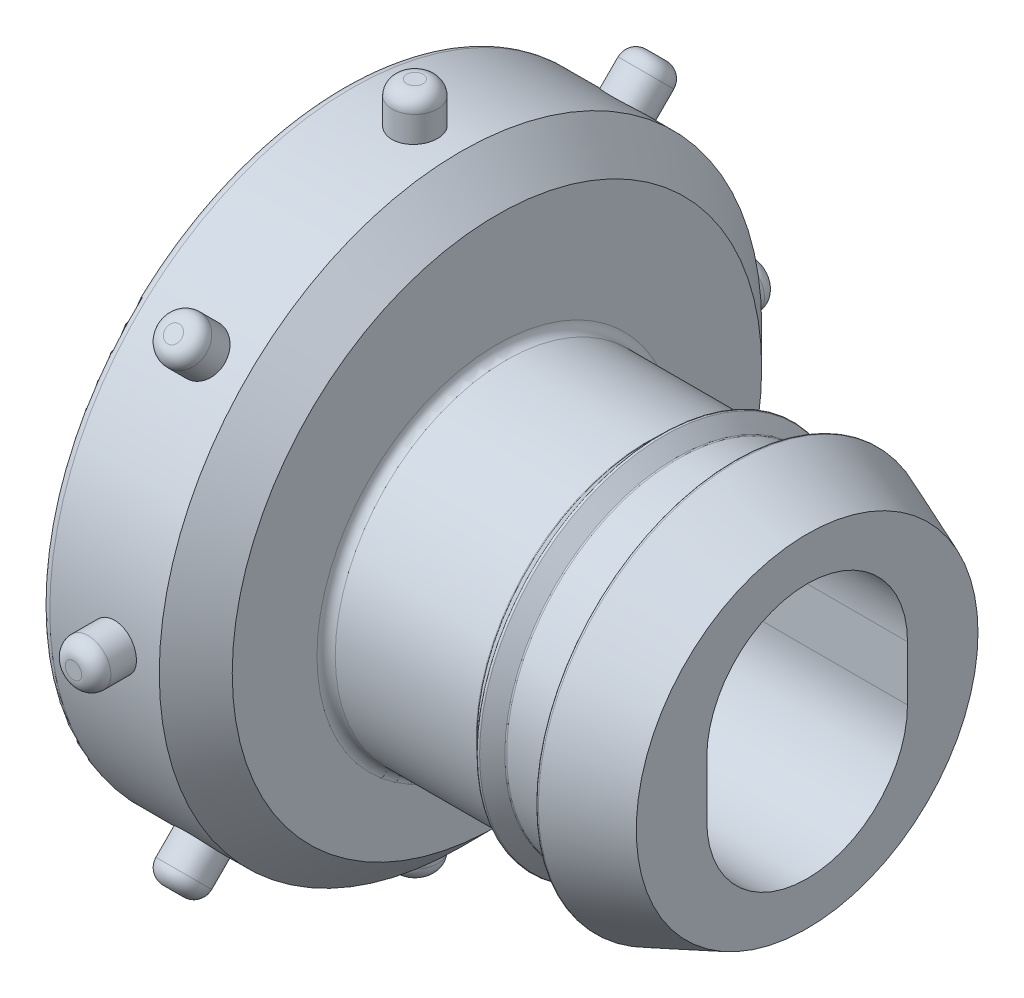
from build123d import *

# Parameters (mm, degrees)
SKETCH2_R                = 16.51
BOSS_EXTRUDE1_DEPTH      = 8.5
SKETCH4_W                = 18.18
SKETCH4_H                = 13.2
CUT_EXTRUDE1_DEPTH       = 7
SKETCH6_R                = 0.9
BOSS_EXTRUDE2_START      = -2
SKETCH7_R                = 1.25
BOSS_EXTRUDE2_DEPTH      = 4.2
FILLET2_R                = 0.8
CIRPATTERN1_COUNT        = 8
FILLET2_OF_CIRPATTERN1_R = 0.8
FILLET4_R                = 0.1
CUT_EXTRUDE2_DEPTH       = 33.365231345
CUT_EXTRUDE2_DEPTH_BACK  = 33.365231345
SKETCH8_W                = 3.59
SKETCH8_H                = 7.65
BOSS_EXTRUDE3_DEPTH      = 0.64
FILLET5_R                = 0.5
FILLET6_R                = 0.5
CHAMFER1_SIZE            = 2
FILLET7_R                = 1
CHAMFER2_SIZE            = 1
CHAMFER2_SIZE2           = 6
FILLET8_R                = 0.5


with BuildPart() as part:
    # Sketch1 → Revolve1 (revolve)
    with BuildSketch(Plane(origin=(0, 0, 0), x_dir=(1, 0, 0), z_dir=(0, 1, 0))):
        Polygon((0, 0), (-17, 0), (-17, 9.365), (-8.73, 9.365), (-7.94, 10.155), (-7.15, 9.365), (-3.97, 9.365), (-3.97, 10.955), (0, 9.365), align=None)
    revolve(axis=Axis((0, 0, 0), (-1, 0, 0)))

    # Sketch2 → Boss-Extrude1 (add)
    with BuildSketch(Plane.ZY.offset(17)):
        with Locations((0, 1.5)):
            Circle(SKETCH2_R)
        with BuildLine():
            ThreePointArc((-5.5, 1.5), (0, 7), (5.5, 1.5))
            Line((5.5, 1.5), (5.5, -1.5))
            ThreePointArc((5.5, -1.5), (0, -7), (-5.5, -1.5))
            Line((-5.5, -1.5), (-5.5, 1.5))
        make_face(mode=Mode.SUBTRACT)
    extrude(amount=BOSS_EXTRUDE1_DEPTH)

    # Sketch4 → Cut-Extrude1 (cut)
    with BuildSketch(Plane.ZY.offset(25.5)):
        with Locations((0, 1.029757623)):
            Rectangle(SKETCH4_W, SKETCH4_H)
    extrude(amount=-CUT_EXTRUDE1_DEPTH, mode=Mode.SUBTRACT)

    # Sketch6 → Cut-Revolve1 (revolve, cut)
    with BuildSketch(Plane.XY, mode=Mode.PRIVATE) as cut_revolve1_sk:
        with Locations((-25.5, 15.64)):
            Circle(SKETCH6_R)
    revolve(cut_revolve1_sk.sketch.rotate(Axis((-25.5, 1.5, 0), (1, 0, 0)), 90), axis=Axis((-25.5, 1.5, 0), (1, 0, 0)), mode=Mode.SUBTRACT)

    # Sketch7 → Boss-Extrude2 (add)
    with BuildSketch(Plane(origin=(0, 18.01, 0), x_dir=(1, 0, 0), z_dir=(0, 1, 0)).offset(BOSS_EXTRUDE2_START)):
        with Locations(Location((-21.5, 0, 0), (0, 0, 270))):
            Circle(SKETCH7_R)
    boss_extrude2 = extrude(amount=BOSS_EXTRUDE2_DEPTH)

    # Fillet2
    fillet2_edges = [part.edges().sort_by_distance(p)[0] for p in [
        (-21.5, 20.21, -1.25),
    ]]
    fillet(fillet2_edges, radius=FILLET2_R)

    # CirPattern1: Boss-Extrude2 ×8 about axis
    cirpattern1_axis = Axis((0, 1.5, 0), (1, 0, 0))
    for i in range(1, CIRPATTERN1_COUNT):
        add(boss_extrude2.rotate(cirpattern1_axis, i * 360 / CIRPATTERN1_COUNT))

    # Fillet2 of CirPattern1
    fillet2_of_cirpattern1_edges = [part.edges().sort_by_distance(p)[0] for p in [
        (-21.5, 15.613851352, 12.3460844),
        (-21.5, 2.75, 18.71),
        (-21.5, -10.8460844, 14.113851352),
        (-21.5, -17.21, 1.25),
        (-21.5, -12.613851352, -12.3460844),
        (-21.5, 0.25, -18.71),
        (-21.5, 13.8460844, -14.113851352),
    ]]
    fillet(fillet2_of_cirpattern1_edges, radius=FILLET2_OF_CIRPATTERN1_R)

    # Fillet4
    fillet4_edges = [part.edges().sort_by_distance(p)[0] for p in [
        (-3.97, 0, 9.365),
        (-3.97, 0, 10.955),
        (-8.73, 0, 9.365),
        (-7.94, 0, 10.155),
        (-7.15, 0, 9.365),
    ]]
    fillet(fillet4_edges, radius=FILLET4_R)

    # Sketch2<3> → Cut-Extrude2 (cut, two sides: drawn at the far end of the back side and taken through both)
    with BuildSketch(Plane.ZY.offset(17).offset(-CUT_EXTRUDE2_DEPTH_BACK)):
        with BuildLine():
            Line((5.5, 0), (5.5, 1.5))
            ThreePointArc((5.5, 1.5), (0, 7), (-5.5, 1.5))
            Line((-5.5, 1.5), (-5.5, 0))
            Line((-5.5, 0), (-5.5, -1.5))
            ThreePointArc((-5.5, -1.5), (0, -7), (5.5, -1.5))
            Line((5.5, -1.5), (5.5, 0))
        make_face()
    extrude(amount=CUT_EXTRUDE2_DEPTH + CUT_EXTRUDE2_DEPTH_BACK, mode=Mode.SUBTRACT)

    # Sketch8 → Boss-Extrude3 (add)
    with BuildSketch(Plane.ZY.offset(18.5)):
        with Locations((7.295, -1.745242377)):
            Rectangle(SKETCH8_W, SKETCH8_H)
    extrude(amount=BOSS_EXTRUDE3_DEPTH)

    # Fillet5
    fillet5_edges = [part.edges().sort_by_distance(p)[0] for p in [
        (-19.14, -1.745242377, 5.5),
        (-19.14, 2.079757623, 7.295),
    ]]
    fillet(fillet5_edges, radius=FILLET5_R)

    # Fillet6
    fillet6_edges = [part.edges().sort_by_distance(p)[0] for p in [
        (-17, 0, 9.365),
    ]]
    fillet(fillet6_edges, radius=FILLET6_R)

    # Chamfer1
    chamfer1_edges = [part.edges().sort_by_distance(p)[0] for p in [
        (-17, 1.5, -16.51),
    ]]
    chamfer(chamfer1_edges, length=CHAMFER1_SIZE)

    # Fillet7
    fillet7_edges = [part.edges().sort_by_distance(p)[0] for p in [
        (-25.5, 1.5, -13.24),
    ]]
    fillet(fillet7_edges, radius=FILLET7_R)

    # Chamfer2
    chamfer2_edges = [part.edges().sort_by_distance(p)[0] for p in [
        (-25.5, 7.629757623, 0),
    ]]
    chamfer2_side = [part.faces().sort_by_distance(p)[0] for p in [
        (-25.5, 1.5, -12.170205593),
    ]]
    chamfer(chamfer2_edges, length=CHAMFER2_SIZE, length2=CHAMFER2_SIZE2, reference=chamfer2_side[0])

    # Fillet8
    fillet8_edges = [part.edges().sort_by_distance(p)[0] for p in [
        (-25.5, 1.5, -16.51),
    ]]
    fillet(fillet8_edges, radius=FILLET8_R)


solid = part.part
